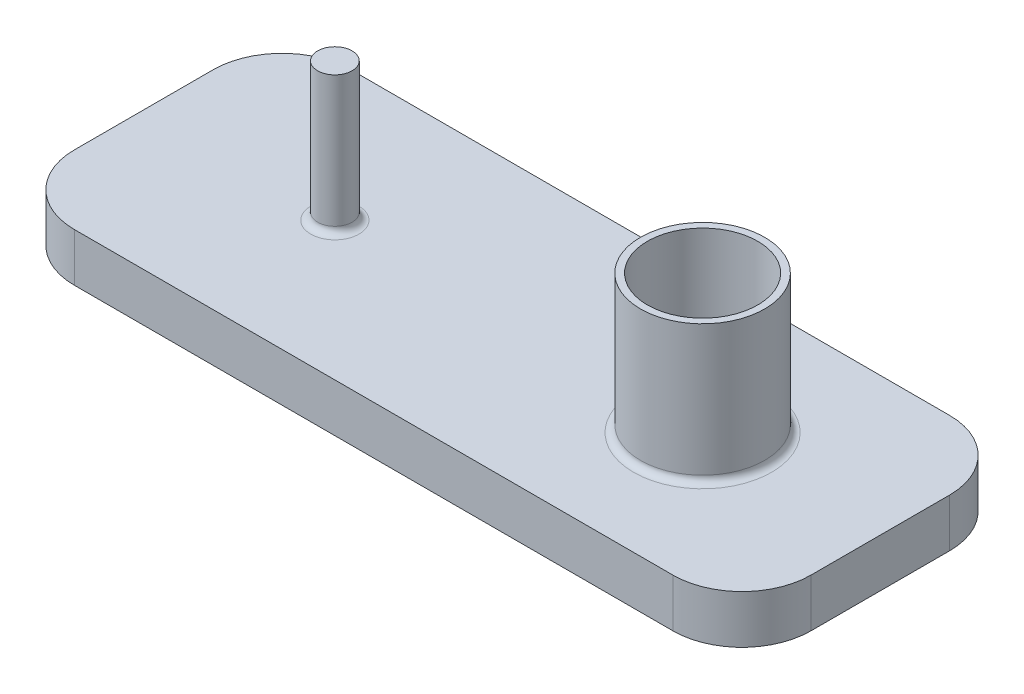
from build123d import *

# Parameters (mm, degrees)
BOSS_EXTRUDE1_DEPTH = 7
SKETCH2_R           = 2.5
SKETCH2_R_2         = 9
SKETCH2_R_3         = 8
BOSS_EXTRUDE2_DEPTH = 20
FILLET1_R           = 1
SCALE1_SCALE        = 5


with BuildPart() as part:
    # Sketch1 → Boss-Extrude1 (new body)
    with BuildSketch(Plane(origin=(0, 0, 0), x_dir=(1, 0, 0), z_dir=(0, 1, 0))):
        with BuildLine():
            Line((-61.391033774, -32.868924483), (25.33933743, -32.868924483))
            ThreePointArc((25.33933743, -32.868924483), (32.410405242, -29.939992295), (35.33933743, -22.868924483))
            Line((35.33933743, -22.868924483), (35.33933743, -2.779955787))
            ThreePointArc((35.33933743, -2.779955787), (32.410405242, 4.291112025), (25.33933743, 7.220044213))
            Line((25.33933743, 7.220044213), (-61.391033774, 7.220044213))
            ThreePointArc((-61.391033774, 7.220044213), (-68.462101586, 4.291112025), (-71.391033774, -2.779955787))
            Line((-71.391033774, -2.779955787), (-71.391033774, -22.868924483))
            ThreePointArc((-71.391033774, -22.868924483), (-68.462101586, -29.939992295), (-61.391033774, -32.868924483))
        make_face()
    extrude(amount=BOSS_EXTRUDE1_DEPTH)

    # Sketch2 → Boss-Extrude2 (add)
    # profile 1 of 2: a face of its own
    with BuildSketch(Plane(origin=(0, 7, 0), x_dir=(1, 0, 0), z_dir=(0, 1, 0))):
        with Locations(Location((-43.693698634, -12.824440135, 0), (0, 0, 270))):
            Circle(SKETCH2_R)
    # profile 2 of 2: a face of its own
    with BuildSketch(Plane(origin=(0, 7, 0), x_dir=(1, 0, 0), z_dir=(0, 1, 0))):
        with Locations(Location((9.591521865, -12.824440135, 0), (0, 0, 270))):
            Circle(SKETCH2_R_2)
        with Locations(Location((9.591521865, -12.824440135, 0), (0, 0, 270))):
            Circle(SKETCH2_R_3, mode=Mode.SUBTRACT)
    extrude(amount=BOSS_EXTRUDE2_DEPTH)

    # Fillet1
    fillet1_edges = [part.edges().sort_by_distance(p)[0] for p in [
        (-43.693698634, 7, 10.324440135),
        (9.591521865, 7, 3.824440135),
    ]]
    fillet(fillet1_edges, radius=FILLET1_R)


with BuildPart() as part_1:
    # Scale1: scaled about (0, 0, 0)
    add(part.part.scale(SCALE1_SCALE))


solid = part_1.part
